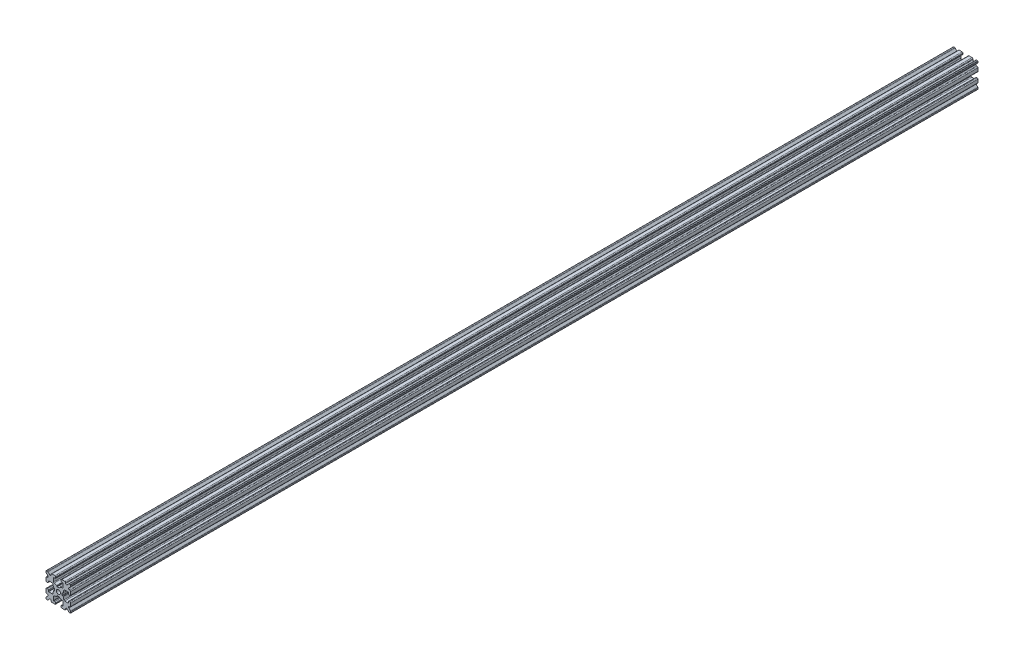
from build123d import *

# Parameters (mm, degrees)
SKETCH1_W           = 15
SKETCH1_H           = 15
SKETCH1_R           = 1.25
BOSS_EXTRUDE1_DEPTH = 275
FILLET1_R           = 0.25
CUT_EXTRUDE1_DEPTH  = 551.10226322
CUT_EXTRUDE3_DEPTH  = 551.10226322
FILLET3_R           = 0.5
FILLET4_R           = 0.5
FILLET5_R           = 3
FILLET6_R           = 0.2
CUT_EXTRUDE4_DEPTH  = 551.10226322
FILLET8_R           = 0.5
SKETCH6_W           = 5.1529354
SKETCH6_H           = 1.651
SKETCH6_W_2         = 1.651
SKETCH6_H_2         = 5.1529354
CUT_EXTRUDE5_DEPTH  = 551.10226322
FILLET10_R          = 0.2


with BuildPart() as part:
    # Sketch1 → Boss-Extrude1 (new, symmetric)
    with BuildSketch(Plane.XY):
        Rectangle(SKETCH1_W, SKETCH1_H)
        Circle(SKETCH1_R, mode=Mode.SUBTRACT)
    extrude(amount=BOSS_EXTRUDE1_DEPTH, both=True)

    # Fillet1
    fillet1_edges = [part.edges().sort_by_distance(p)[0] for p in [
        (7.5, -7.5, 0),
        (-7.5, -7.5, 0),
        (-7.5, 7.5, 0),
        (7.5, 7.5, 0),
    ]]
    fillet(fillet1_edges, radius=FILLET1_R)

    # Sketch2 → Cut-Extrude1 (cut, through all)
    with BuildSketch(Plane.XY.offset(275)):
        Polygon((-7.5, 1.6), (-6.1, 1.6), (-6.1, 2.9), (-3.4, 2.9), (-3.4, -2.9), (-6.1, -2.9), (-6.1, -1.6), (-7.5, -1.6), align=None)
        Polygon((2.9, 6.1), (1.6, 6.1), (1.6, 7.5), (-1.6, 7.5), (-1.6, 6.1), (-2.9, 6.1), (-2.9, 3.4), (2.9, 3.4), align=None)
        Polygon((-1.6, -7.5), (-1.6, -6.1), (-2.9, -6.1), (-2.9, -3.4), (2.9, -3.4), (2.9, -6.1), (1.6, -6.1), (1.6, -7.5), align=None)
        Polygon((6.1, -2.9), (6.1, -1.6), (7.5, -1.6), (7.5, 1.6), (6.1, 1.6), (6.1, 2.9), (3.4, 2.9), (3.4, -2.9), align=None)
    extrude(amount=-CUT_EXTRUDE1_DEPTH, mode=Mode.SUBTRACT)

    # Sketch4 → Cut-Extrude3 (cut, through all)
    with BuildSketch(Plane.XY.offset(275)):
        Polygon((-3.4, 2.9), (-2.75, 0), (-3.4, -2.9), align=None)
        Polygon((-2.9, 3.4), (0, 2.75), (2.9, 3.4), align=None)
        Polygon((3.4, 2.9), (2.75, 0), (3.4, -2.9), align=None)
        Polygon((-2.9, -3.4), (0, -2.75), (2.9, -3.4), align=None)
    extrude(amount=-CUT_EXTRUDE3_DEPTH, mode=Mode.SUBTRACT)

    # Fillet3
    fillet3_edges = [part.edges().sort_by_distance(p)[0] for p in [
        (1.6, -7.5, 0),
        (-1.6, -7.5, 0),
        (-1.6, -6.1, 0),
        (1.6, -6.1, 0),
        (6.1, 1.6, 0),
        (7.5, 1.6, 0),
        (7.5, -1.6, 0),
        (6.1, -1.6, 0),
        (-7.5, -1.6, 0),
        (-7.5, 1.6, 0),
        (-6.1, 1.6, 0),
        (-6.1, -1.6, 0),
        (-1.6, 6.1, 0),
        (-1.6, 7.5, 0),
        (1.6, 7.5, 0),
        (1.6, 6.1, 0),
    ]]
    fillet(fillet3_edges, radius=FILLET3_R)

    # Fillet4
    fillet4_edges = [part.edges().sort_by_distance(p)[0] for p in [
        (-2.9, -3.4, 0),
        (2.9, -3.4, 0),
        (3.4, -2.9, 0),
        (3.4, 2.9, 0),
        (-3.4, 2.9, 0),
        (-3.4, -2.9, 0),
        (2.9, 3.4, 0),
        (-2.9, 3.4, 0),
    ]]
    fillet(fillet4_edges, radius=FILLET4_R)

    # Fillet5
    fillet5_edges = [part.edges().sort_by_distance(p)[0] for p in [
        (-2.75, 0, 0),
        (0, 2.75, 0),
        (2.75, 0, 0),
        (0, -2.75, 0),
    ]]
    fillet(fillet5_edges, radius=FILLET5_R)

    # Fillet6
    fillet6_edges = [part.edges().sort_by_distance(p)[0] for p in [
        (-2.9, -6.1, 0),
        (2.9, -6.1, 0),
        (6.1, -2.9, 0),
        (6.1, 2.9, 0),
        (-6.1, 2.9, 0),
        (-6.1, -2.9, 0),
        (2.9, 6.1, 0),
        (-2.9, 6.1, 0),
    ]]
    fillet(fillet6_edges, radius=FILLET6_R)

    # Sketch5 → Cut-Extrude4 (cut, through all)
    with BuildSketch(Plane.XY.offset(275)):
        Polygon((-7.5, 6.439339828), (-5.460660172, 4.4), (-7.5, 4.4), align=None)
        Polygon((-6.439339828, 7.5), (-4.4, 5.460660172), (-4.4, 7.5), align=None)
        Polygon((4.4, 7.5), (6.439339828, 7.5), (4.4, 5.460660172), align=None)
        Polygon((7.5, 6.439339828), (7.5, 4.4), (5.460660172, 4.4), align=None)
        Polygon((7.5, -6.439339828), (5.460660172, -4.4), (7.5, -4.4), align=None)
        Polygon((6.439339828, -7.5), (4.4, -5.460660172), (4.4, -7.5), align=None)
        Polygon((-4.4, -7.5), (-6.439339828, -7.5), (-4.4, -5.460660172), align=None)
        Polygon((-7.5, -6.439339828), (-7.5, -4.4), (-5.460660172, -4.4), align=None)
    extrude(amount=-CUT_EXTRUDE4_DEPTH, mode=Mode.SUBTRACT)

    # Fillet8
    fillet8_edges = [part.edges().sort_by_distance(p)[0] for p in [
        (-7.5, 4.4, 0),
        (-7.5, 6.439339828, 0),
        (-5.460660172, 4.4, 0),
        (7.5, -4.4, 0),
        (7.5, -6.439339828, 0),
        (5.460660172, -4.4, 0),
        (5.460660172, 4.4, 0),
        (7.5, 6.439339828, 0),
        (7.5, 4.4, 0),
        (-4.4, 7.5, 0),
        (-4.4, 5.460660172, 0),
        (-6.439339828, 7.5, 0),
        (-5.460660172, -4.4, 0),
        (-7.5, -6.439339828, 0),
        (-7.5, -4.4, 0),
        (4.4, 5.460660172, 0),
        (4.4, 7.5, 0),
        (6.439339828, 7.5, 0),
        (6.439339828, -7.5, 0),
        (4.4, -7.5, 0),
        (4.4, -5.460660172, 0),
        (-6.439339828, -7.5, 0),
        (-4.4, -5.460660172, 0),
        (-4.4, -7.5, 0),
    ]]
    fillet(fillet8_edges, radius=FILLET8_R)

    # Sketch6 → Cut-Extrude5 (cut, through all)
    with BuildSketch(Plane.XY.offset(275)):
        with Locations((4.9235323, 0)):
            Rectangle(SKETCH6_W, SKETCH6_H)
        with Locations((0, -4.9235323)):
            Rectangle(SKETCH6_W_2, SKETCH6_H_2)
        with Locations((-4.9235323, 0)):
            Rectangle(SKETCH6_W, SKETCH6_H)
        with Locations((0, 4.9235323)):
            Rectangle(SKETCH6_W_2, SKETCH6_H_2)
    extrude(amount=-CUT_EXTRUDE5_DEPTH, mode=Mode.SUBTRACT)

    # Fillet10
    fillet10_edges = [part.edges().sort_by_distance(p)[0] for p in [
        (0.8255, -2.935025862, 0),
        (-0.8255, -2.935025862, 0),
        (0.8255, -2.3470646, 0),
        (-0.8255, -2.3470646, 0),
        (2.935025862, 0.8255, 0),
        (2.935025862, -0.8255, 0),
        (2.3470646, 0.8255, 0),
        (2.3470646, -0.8255, 0),
        (-2.935025862, -0.8255, 0),
        (-2.935025862, 0.8255, 0),
        (-2.3470646, -0.8255, 0),
        (-2.3470646, 0.8255, 0),
        (-0.8255, 2.935025862, 0),
        (0.8255, 2.935025862, 0),
        (-0.8255, 2.3470646, 0),
        (0.8255, 2.3470646, 0),
    ]]
    fillet(fillet10_edges, radius=FILLET10_R)


solid = part.part
